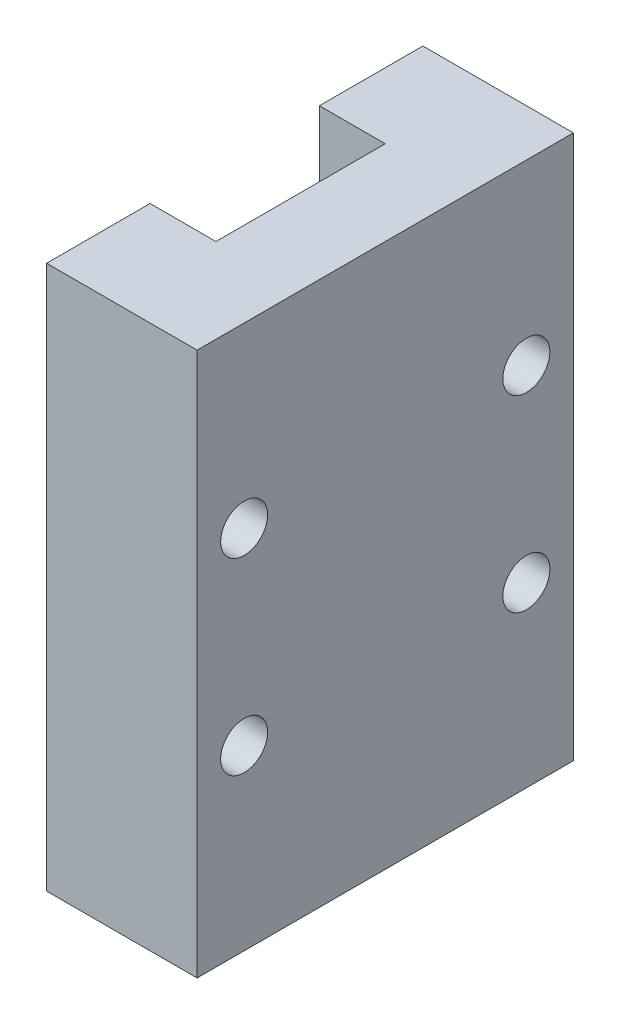
from build123d import *

# Parameters (mm, degrees)
SKETCH_1_W             = 20
SKETCH_1_H             = 28.9
EXTRUDE_1_DEPTH        = 8
SKETCH_2_W             = 3.5
SKETCH_2_H             = 9
CUT_EXTRUDE_1_DEPTH    = 32.610283137
HOLE_WIZARD_M3_1_D     = 2.5
HOLE_WIZARD_M3_1_DEPTH = 6.5
HOLE_WIZARD_M3_1_TIP   = 0.751075774


with BuildPart() as part:
    # 草图1 → 凸台-拉伸1 (new body)
    with BuildSketch(Plane(origin=(0, 0, 0), x_dir=(0, 0, -1), z_dir=(1, 0, 0))):
        Rectangle(SKETCH_1_W, SKETCH_1_H)
    extrude(amount=EXTRUDE_1_DEPTH)

    # 草图2 → 切除-拉伸1 (cut, through all)
    with BuildSketch(Plane(origin=(0, 14.45, 0), x_dir=(1, 0, 0), z_dir=(0, 1, 0))):
        with Locations((1.75, 0)):
            Rectangle(SKETCH_2_W, SKETCH_2_H)
    extrude(amount=-CUT_EXTRUDE_1_DEPTH, mode=Mode.SUBTRACT)

    # M3 螺纹孔1
    with Locations(Plane(origin=(8, 0, 0), x_dir=(0, 0, -1), z_dir=(1, 0, 0))):
        with Locations((-7.5, 5), (7.5, -5), (-7.5, -5), (7.5, 5)):
            Hole(HOLE_WIZARD_M3_1_D / 2, depth=HOLE_WIZARD_M3_1_DEPTH)
            with Locations((0, 0, -(HOLE_WIZARD_M3_1_DEPTH + HOLE_WIZARD_M3_1_TIP / 2))):  # 118° drill point
                Cone(0, HOLE_WIZARD_M3_1_D / 2, HOLE_WIZARD_M3_1_TIP, mode=Mode.SUBTRACT)


solid = part.part
